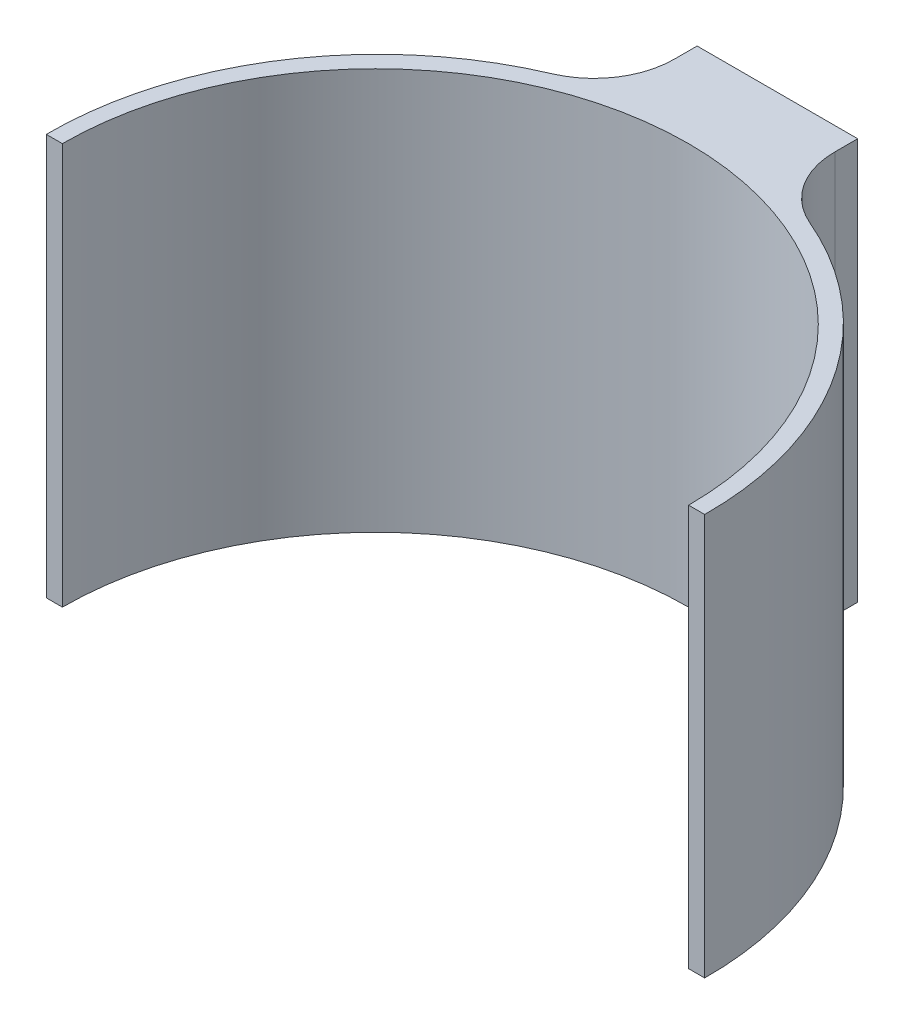
from build123d import *

# Parameters (mm, degrees)
BOSS_EXTRU_1_DEPTH = 50
CONG_1_R           = 10


with BuildPart() as part:
    # Esquisse1 → Boss.-Extru.1 (new body)
    with BuildSketch(Plane(origin=(0, 0, 0), x_dir=(1, 0, 0), z_dir=(0, 1, 0))):
        with BuildLine():
            Line((0, 0), (-2, 0))
            ThreePointArc((-2, 0), (6.574510491, 25.388511074), (29, 40.058076335))
            Line((29, 40.058076335), (29, 50.058076335))
            Line((29, 50.058076335), (49, 50.058076335))
            Line((49, 50.058076335), (49, 40.058076335))
            ThreePointArc((49, 40.058076335), (71.425489509, 25.388511074), (80, 0))
            Line((80, 0), (78, 0))
            ThreePointArc((78, 0), (39, 39), (0, 0))
        make_face()
    extrude(amount=BOSS_EXTRU_1_DEPTH)

    # Congé1
    cong_1_edges = [part.edges().sort_by_distance(p)[0] for p in [
        (29, 25, -40.058076335),
        (49, 25, -40.058076335),
    ]]
    fillet(cong_1_edges, radius=CONG_1_R)


solid = part.part
